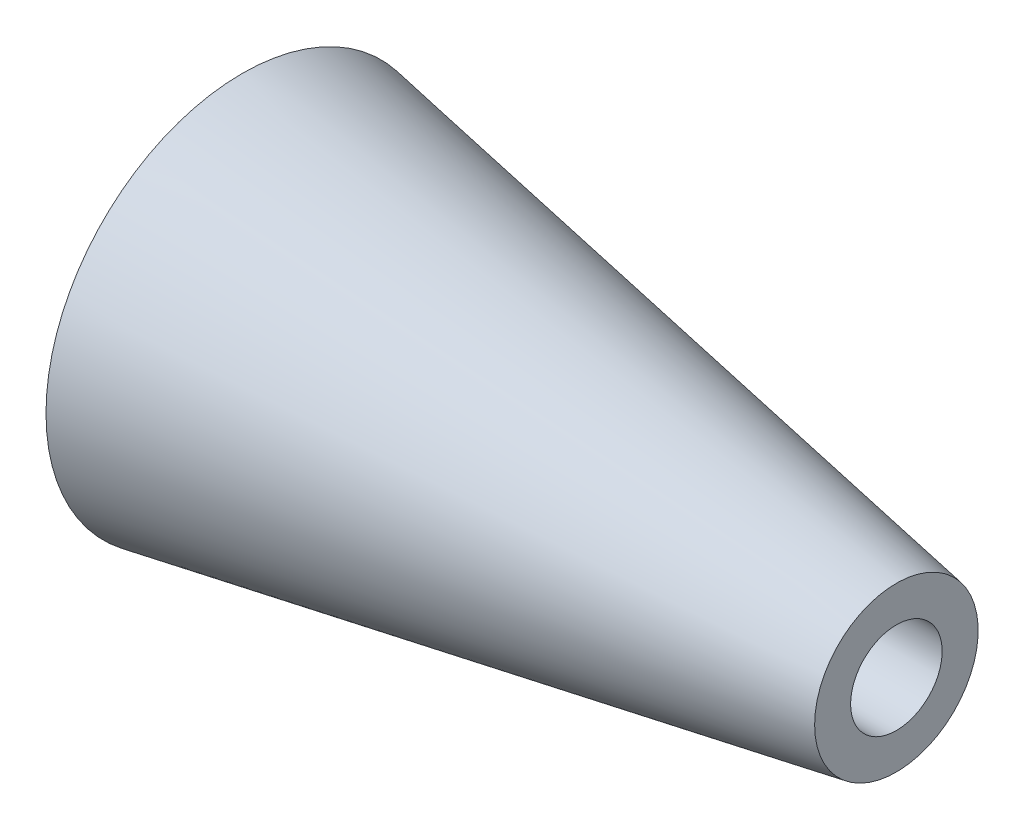
from build123d import *


with BuildPart() as part:
    # Sketch1 → Revolve1 (revolve)
    with BuildSketch(Plane.XY, mode=Mode.PRIVATE) as revolve1_sk:
        Polygon((0, 0.7), (10, 0.7), (10, 1.25), (0, 3), align=None)
    revolve(revolve1_sk.sketch.rotate(Axis((0, 0, 0), (1, 0, 0)), 90), axis=Axis((0, 0, 0), (1, 0, 0)))


solid = part.part
